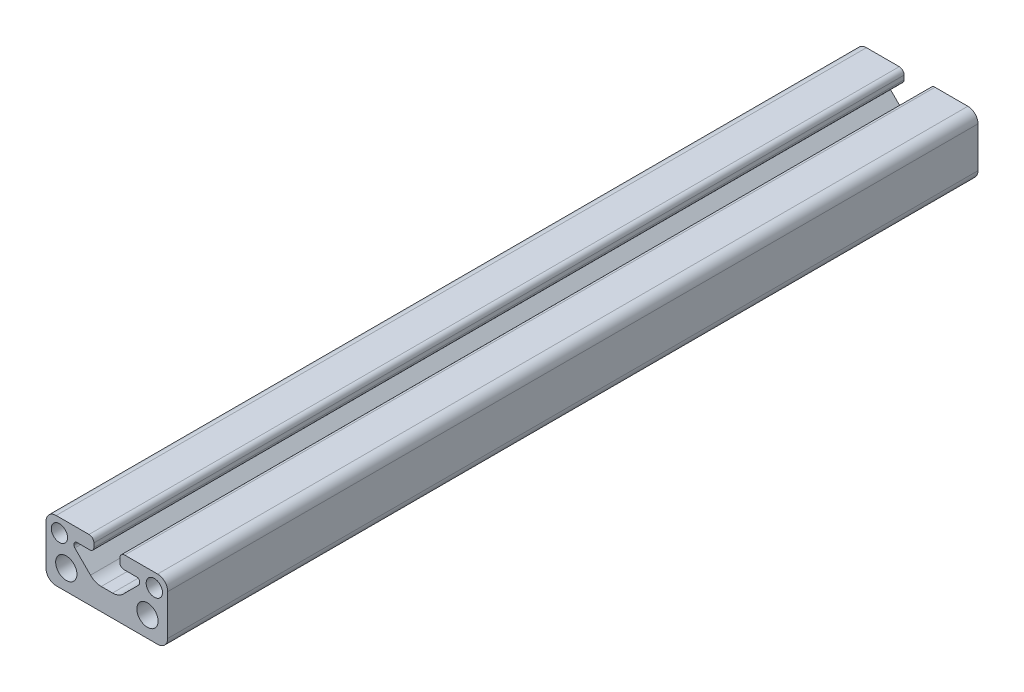
from build123d import *

# Parameters (mm, degrees)
SKETCH2_R           = 2.5527
SKETCH2_R_2         = 3.3274
BOSS_EXTRUDE1_DEPTH = 126.785


with BuildPart() as part:
    # Sketch2 → Boss-Extrude1 (new, symmetric)
    with BuildSketch(Plane.XY):
        with BuildLine():
            Line((-10.287, 4.255364987), (-10.287, 4.572))
            ThreePointArc((-10.287, 4.572), (-10.026617928, 5.200617928), (-9.398, 5.461))
            Line((-9.398, 5.461), (-5.334, 5.461))
            ThreePointArc((-5.334, 5.461), (-4.435974388, 5.832974388), (-4.064, 6.731))
            Line((-4.064, 6.731), (-4.064, 8.001))
            ThreePointArc((-4.064, 8.001), (-4.510369265, 9.078630735), (-5.588, 9.525))
            Line((-5.588, 9.525), (-15.875, 9.525))
            ThreePointArc((-15.875, 9.525), (-18.12006403, 8.59506403), (-19.05, 6.35))
            Line((-19.05, 6.35), (-19.05, -6.35))
            ThreePointArc((-19.05, -6.35), (-18.12006403, -8.59506403), (-15.875, -9.525))
            Line((-15.875, -9.525), (15.875, -9.525))
            ThreePointArc((15.875, -9.525), (18.12006403, -8.59506403), (19.05, -6.35))
            Line((19.05, -6.35), (19.05, 6.35))
            ThreePointArc((19.05, 6.35), (18.12006403, 8.59506403), (15.875, 9.525))
            Line((15.875, 9.525), (5.588, 9.525))
            ThreePointArc((5.588, 9.525), (4.510369265, 9.078630735), (4.064, 8.001))
            Line((4.064, 8.001), (4.064, 6.731))
            ThreePointArc((4.064, 6.731), (4.435974388, 5.832974388), (5.334, 5.461))
            Line((5.334, 5.461), (9.398, 5.461))
            ThreePointArc((9.398, 5.461), (10.026617928, 5.200617928), (10.287, 4.572))
            Line((10.287, 4.572), (10.287, 4.255364987))
            ThreePointArc((10.287, 4.255364987), (10.219328904, 3.915159416), (10.026617928, 3.626747059))
            Line((10.026617928, 3.626747059), (5.124055081, -1.275815789))
            ThreePointArc((5.124055081, -1.275815789), (3.583109058, -2.305443004), (1.765439291, -2.667))
            Line((1.765439291, -2.667), (-1.765439291, -2.667))
            ThreePointArc((-1.765439291, -2.667), (-3.583109058, -2.305443004), (-5.124055081, -1.275815789))
            Line((-5.124055081, -1.275815789), (-10.026617928, 3.626747059))
            ThreePointArc((-10.026617928, 3.626747059), (-10.219328904, 3.915159416), (-10.287, 4.255364987))
        make_face()
        with Locations((-14.848796959, 5.276432773)):
            Circle(SKETCH2_R, mode=Mode.SUBTRACT)
        with Locations((-12.7, -3.175)):
            Circle(SKETCH2_R_2, mode=Mode.SUBTRACT)
        with Locations((12.7, -3.175)):
            Circle(SKETCH2_R_2, mode=Mode.SUBTRACT)
        with Locations((14.848796959, 5.276432773)):
            Circle(SKETCH2_R, mode=Mode.SUBTRACT)
    extrude(amount=BOSS_EXTRUDE1_DEPTH, both=True)


solid = part.part
